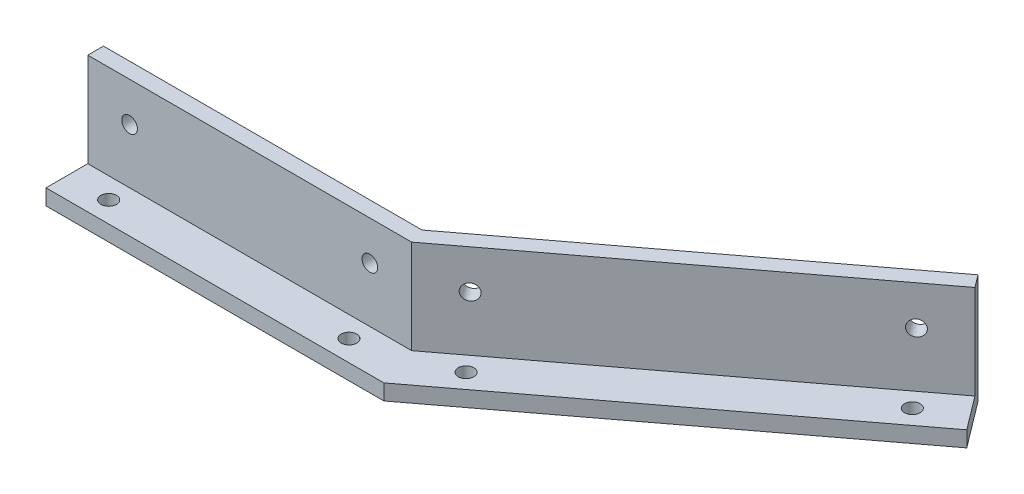
from build123d import *

# Parameters (mm, degrees)
SALIENTE_EXTRUIR1_DEPTH      = 3
CROQUIS2_R                   = 1.5
CORTAR_EXTRUIR1_DEPTH        = 3
CROQUIS3_R                   = 1.5
CORTAR_EXTRUIR2_DEPTH        = 3
SALIENTE_EXTRUIR2_DEPTH      = 18
SALIENTE_EXTRUIR2_DEPTH_BACK = 3
CROQUIS5_R                   = 1.5
CORTAR_EXTRUIR3_DEPTH        = 3
CROQUIS6_R                   = 1.5
CORTAR_EXTRUIR4_DEPTH        = 3


with BuildPart() as part:
    # Croquis1 → Saliente-Extruir1 (new body)
    with BuildSketch(Plane(origin=(0, 0, 0), x_dir=(1, 0, 0), z_dir=(0, 1, 0))):
        Polygon((0, 0), (62, 0), (123.449927666, 46.399422301), (128.270646866, 40.015014231), (64.681080335, -8), (0, -8), align=None)
    extrude(amount=SALIENTE_EXTRUIR1_DEPTH)

    # Croquis2 → Cortar-Extruir1 (cut)
    with BuildSketch(Plane(origin=(0, 3, 0), x_dir=(1, 0, 0), z_dir=(0, 1, 0))):
        with Locations(Location((8, -4, 0), (0, 0, 270))):
            Circle(CROQUIS2_R)
        with Locations(Location((54, -4, 0), (0, 0, 270))):
            Circle(CROQUIS2_R)
    extrude(amount=-CORTAR_EXTRUIR1_DEPTH, mode=Mode.SUBTRACT)

    # Croquis3 → Cortar-Extruir2 (cut)
    with BuildSketch(Plane(origin=(0, 3, 0), x_dir=(1, 0, 0), z_dir=(0, 1, 0))):
        with Locations(Location((70.794767669, 1.628515165, 0), (0, 0, 270))):
            Circle(CROQUIS3_R)
        with Locations(Location((119.475879197, 38.386499066, 0), (0, 0, 270))):
            Circle(CROQUIS3_R)
    extrude(amount=-CORTAR_EXTRUIR2_DEPTH, mode=Mode.SUBTRACT)

    # Croquis4 → Saliente-Extruir2 (add, two sides: drawn at the far end of the back side and taken through both)
    with BuildSketch(Plane(origin=(0, 3, 0), x_dir=(1, 0, 0), z_dir=(0, 1, 0)).offset(-SALIENTE_EXTRUIR2_DEPTH_BACK)):
        Polygon((0, 0), (0, 3), (60.994594874, 3), (121.642157966, 48.793575327), (123.449927666, 46.399422301), (62, 0), align=None)
    extrude(amount=SALIENTE_EXTRUIR2_DEPTH + SALIENTE_EXTRUIR2_DEPTH_BACK)

    # Croquis5 → Cortar-Extruir3 (cut)
    with BuildSketch(Plane.XY):
        with Locations((8, 13.5)):
            Circle(CROQUIS5_R)
        with Locations((54, 13.5)):
            Circle(CROQUIS5_R)
    extrude(amount=-CORTAR_EXTRUIR3_DEPTH, mode=Mode.SUBTRACT)

    # Croquis6 → Cortar-Extruir4 (cut)
    with BuildSketch(Plane(origin=(22.513104431, 0, 29.815643605), x_dir=(0.798051008651339, 0, -0.6025899000071112), z_dir=(0.6025899000071112, 0, 0.798051008651339))):
        with Locations((57.479162536, 13.5)):
            Circle(CROQUIS6_R)
        with Locations((118.479162536, 13.5)):
            Circle(CROQUIS6_R)
    extrude(amount=-CORTAR_EXTRUIR4_DEPTH, mode=Mode.SUBTRACT)


solid = part.part
